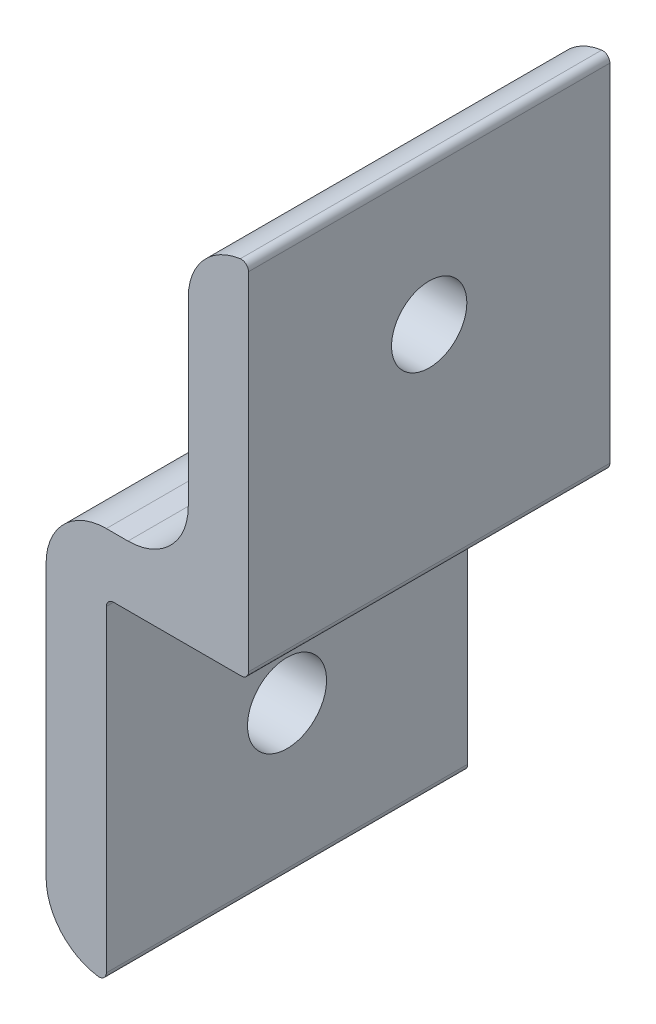
from build123d import *

# Parameters (mm, degrees)
BOSS_EXTRUDE1_DEPTH      = 38.1
M7_CLEARANCE_HOLE1_D     = 7.9375
M7_CLEARANCE_HOLE1_DEPTH = 21.336
HOLE1_D                  = 8.3312
HOLE1_DEPTH              = 21.336
FILLET1_R                = 0.762
FILLET2_R                = 6.35


with BuildPart() as part:
    # Sketch1 → Boss-Extrude1 (new body)
    with BuildSketch(Plane(origin=(0, 0, 0), x_dir=(-1, 0, 0), z_dir=(0, 0, -1))):
        with BuildLine():
            Line((21.0747321, -31.51018077), (6.0887321, -31.51018077))
            Line((6.0887321, -31.51018077), (6.0887321, -6.11018077))
            ThreePointArc((6.0887321, -6.11018077), (4.228860161, -1.620052709), (-0.2612679, 0.23981923))
            Line((-0.2612679, 0.23981923), (-0.2612679, -37.86018077))
            Line((-0.2612679, -37.86018077), (14.7247321, -37.86018077))
            Line((14.7247321, -37.86018077), (14.7247321, -72.88678077))
            ThreePointArc((14.7247321, -72.88678077), (19.214860161, -71.02690883), (21.0747321, -66.53678077))
            Line((21.0747321, -66.53678077), (21.0747321, -31.51018077))
        make_face()
    extrude(amount=-BOSS_EXTRUDE1_DEPTH)

    # M7 Clearance Hole1
    with Locations(Plane(origin=(0.2612679, 0, 0), x_dir=(0, 0, -1), z_dir=(1, 0, 0))):
        with Locations((-19.05, -14.90620077)):
            Hole(M7_CLEARANCE_HOLE1_D / 2, depth=M7_CLEARANCE_HOLE1_DEPTH)

    # Hole1
    with Locations(Plane.ZY.offset(21.0747321)):
        with Locations((19.05, -56.96352077)):
            Hole(HOLE1_D / 2, depth=HOLE1_DEPTH)

    # Fillet1
    fillet1_edges = [part.edges().sort_by_distance(p)[0] for p in [
        (-14.7247321, -72.88678077, 19.05),
        (-14.7247321, -37.86018077, 19.05),
        (0.2612679, -37.86018077, 19.05),
        (0.2612679, 0.23981923, 19.05),
    ]]
    fillet(fillet1_edges, radius=FILLET1_R)

    # Fillet2
    fillet2_edges = [part.edges().sort_by_distance(p)[0] for p in [
        (-6.0887321, -31.51018077, 19.05),
        (-21.0747321, -31.51018077, 19.05),
    ]]
    fillet(fillet2_edges, radius=FILLET2_R)


solid = part.part
